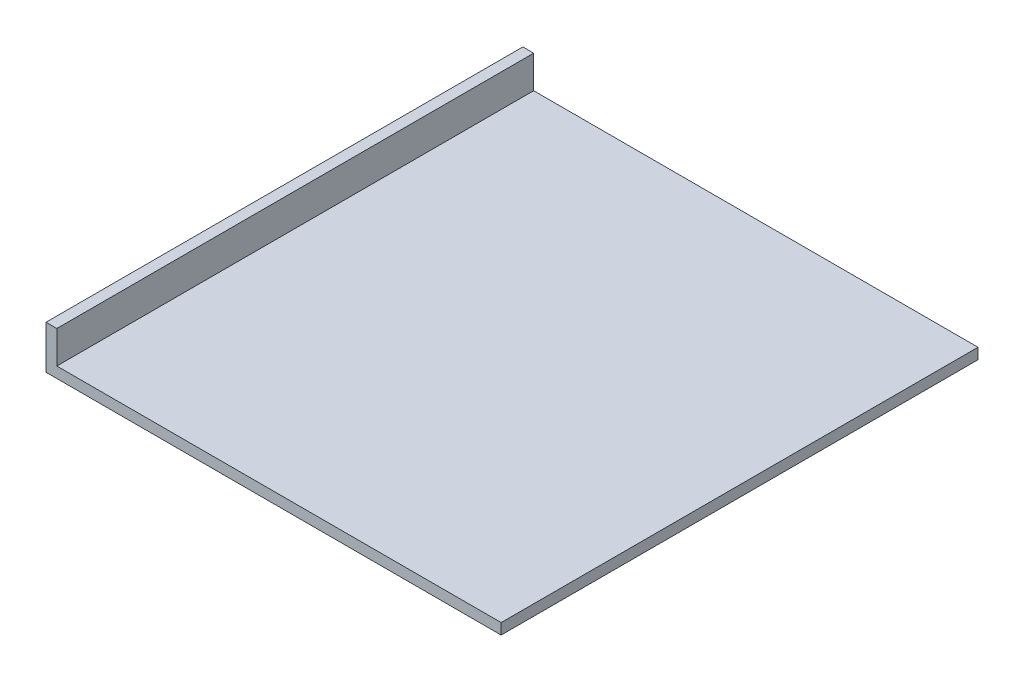
from build123d import *

# Parameters (mm, degrees)
SKETCH1_W           = 210
SKETCH1_H           = 220
BOSS_EXTRUDE1_DEPTH = 5
SKETCH2_W           = 5
SKETCH2_H           = 220
BOSS_EXTRUDE3_DEPTH = 15


with BuildPart() as part:
    # Sketch1 → Boss-Extrude1 (new body)
    with BuildSketch(Plane(origin=(0, 0, 0), x_dir=(1, 0, 0), z_dir=(0, 1, 0))):
        Rectangle(SKETCH1_W, SKETCH1_H)
    extrude(amount=BOSS_EXTRUDE1_DEPTH)

    # Sketch2 → Boss-Extrude3 (add)
    with BuildSketch(Plane(origin=(0, 5, 0), x_dir=(1, 0, 0), z_dir=(0, 1, 0))):
        with Locations((-102.5, 0)):
            Rectangle(SKETCH2_W, SKETCH2_H)
    extrude(amount=BOSS_EXTRUDE3_DEPTH)


solid = part.part
